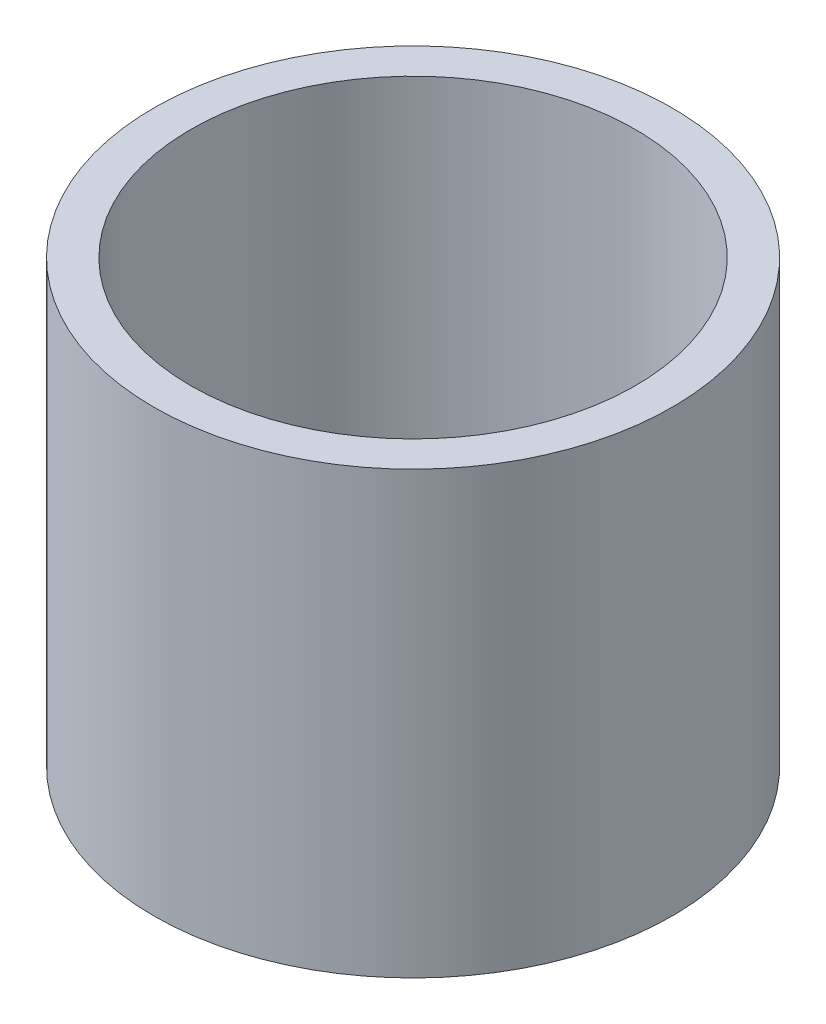
from build123d import *

# Parameters (mm, degrees)
SKETCH_1_R          = 35
EXTRUDE_1_DEPTH     = 59.5
SKETCH_2_R          = 30
CUT_EXTRUDE_1_DEPTH = 59


with BuildPart() as part:
    # 스케치1 → 보스-돌출1 (new body)
    with BuildSketch(Plane(origin=(0, 0, 0), x_dir=(1, 0, 0), z_dir=(0, 1, 0))):
        with Locations(Location((0, 0, 0), (0, 0, 270))):
            Circle(SKETCH_1_R)
    extrude(amount=EXTRUDE_1_DEPTH)

    # 스케치2 → 컷-돌출1 (cut)
    with BuildSketch(Plane(origin=(0, 5, 0), x_dir=(1, 0, 0), z_dir=(0, 1, 0))):
        with Locations(Location((0, 0, 0), (0, 0, 270))):
            Circle(SKETCH_2_R)
    extrude(amount=CUT_EXTRUDE_1_DEPTH, mode=Mode.SUBTRACT)


solid = part.part
